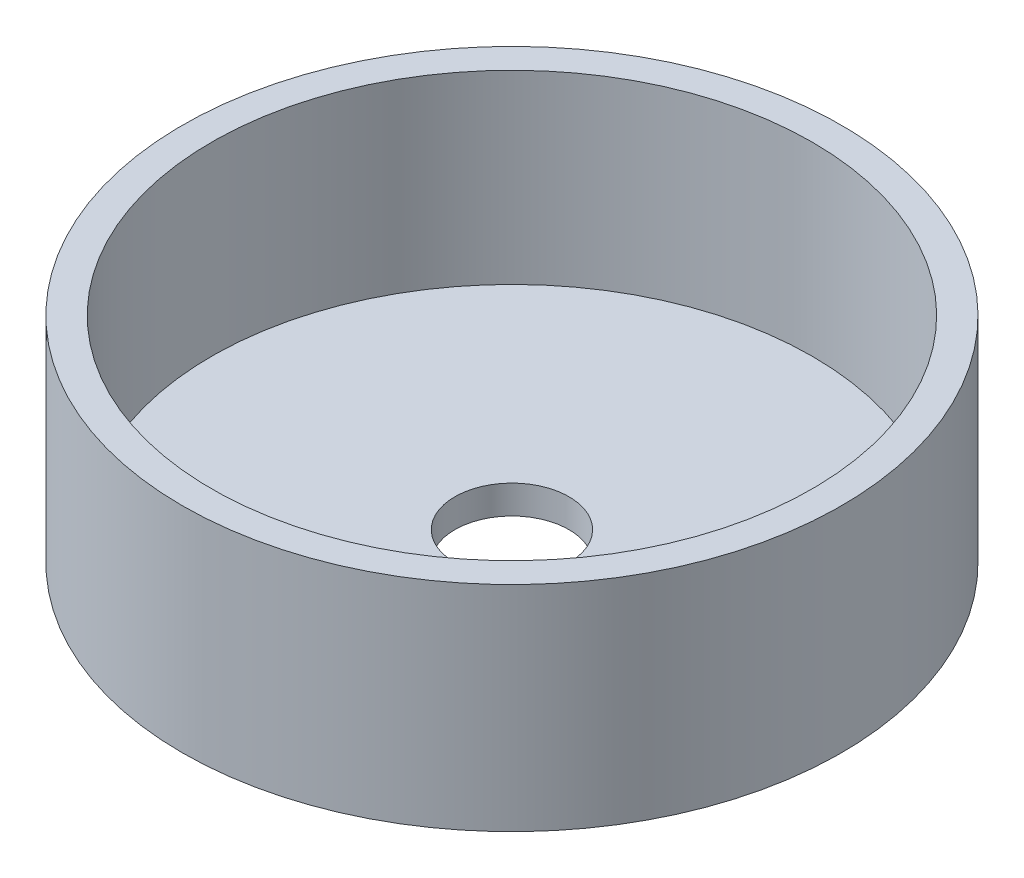
from build123d import *

# Parameters (mm, degrees)
SKETCH_1_R          = 23.1
EXTRUDE_1_DEPTH     = 2
SKETCH_2_R          = 23.1
SKETCH_2_R_2        = 21.05
EXTRUDE_2_DEPTH     = 13
SKETCH_3_R          = 4
CUT_EXTRUDE_1_DEPTH = 36.159920364


with BuildPart() as part:
    # 草图1 → 凸台-拉伸1 (new body)
    with BuildSketch(Plane(origin=(0, 0, 0), x_dir=(1, 0, 0), z_dir=(0, 1, 0))):
        with Locations(Location((0, 0, 0), (0, 0, 270))):
            Circle(SKETCH_1_R)
    extrude(amount=EXTRUDE_1_DEPTH)

    # 草图2 → 凸台-拉伸2 (add)
    with BuildSketch(Plane(origin=(0, 2, 0), x_dir=(1, 0, 0), z_dir=(0, 1, 0))):
        with Locations(Location((0, 0, 0), (0, 0, 270))):
            Circle(SKETCH_2_R)
        with Locations(Location((0, 0, 0), (0, 0, 90))):
            Circle(SKETCH_2_R_2, mode=Mode.SUBTRACT)
    extrude(amount=EXTRUDE_2_DEPTH)

    # 草图3 → 切除-拉伸1 (cut, through all)
    with BuildSketch(Plane(origin=(0, 2, 0), x_dir=(1, 0, 0), z_dir=(0, 1, 0))):
        with Locations(Location((0, 0, 0), (0, 0, 270))):
            Circle(SKETCH_3_R)
    extrude(amount=-CUT_EXTRUDE_1_DEPTH, mode=Mode.SUBTRACT)


solid = part.part
